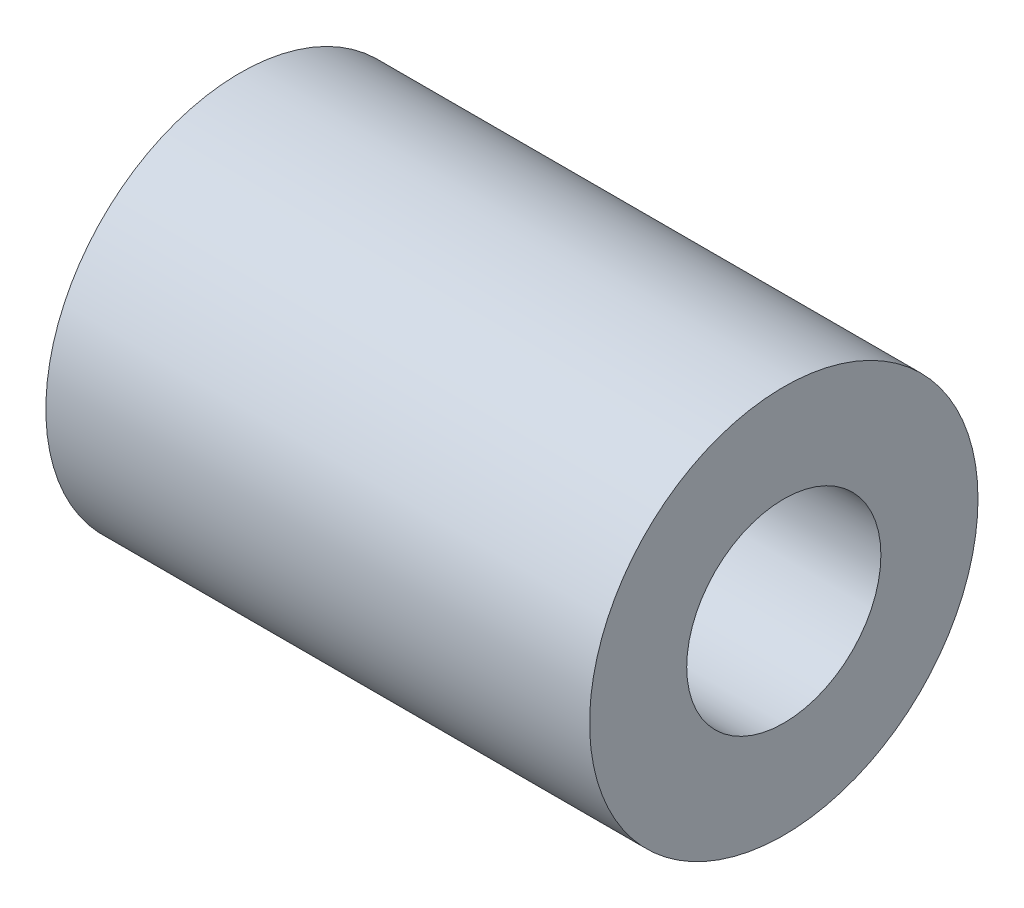
from build123d import *

# Parameters (mm, degrees)
SKETCH1_R           = 2.5
SKETCH1_R_2         = 1.25
BOSS_EXTRUDE1_DEPTH = 7


with BuildPart() as part:
    # Sketch1 → Boss-Extrude1 (new body)
    with BuildSketch(Plane(origin=(0, 0, 0), x_dir=(0, 0, -1), z_dir=(1, 0, 0))):
        Circle(SKETCH1_R)
        Circle(SKETCH1_R_2, mode=Mode.SUBTRACT)
    extrude(amount=BOSS_EXTRUDE1_DEPTH)


solid = part.part
